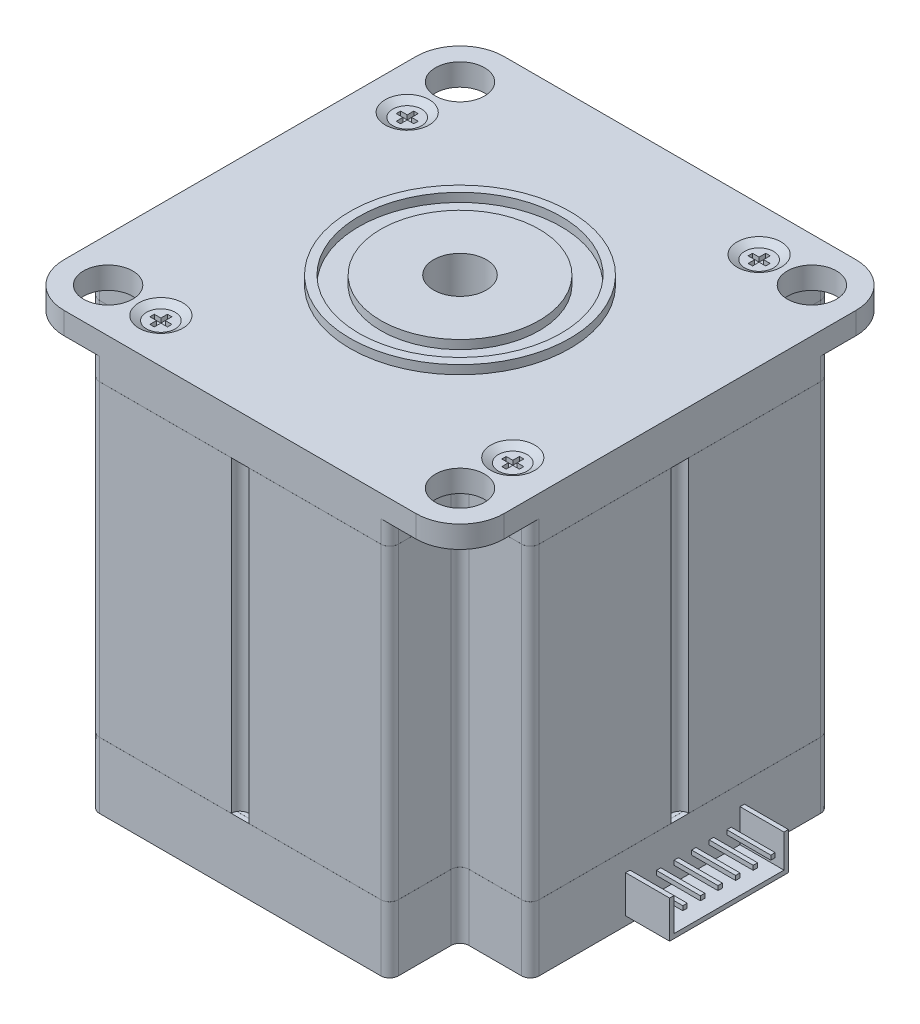
from build123d import *

# Parameters (mm, degrees)
SKETCH1_R                    = 5.580556693
BOSS_EXTRUDE1_DEPTH          = 2.5
SKETCH2_R                    = 5
CUT_EXTRUDE1_DEPTH           = 1
CUT_EXTRUDE1_DRAFT           = -60
CUT_EXTRUDE1_PROFILE_2_DEPTH = 1
CUT_EXTRUDE1_PROFILE_2_DRAFT = -60
CUT_EXTRUDE1_PROFILE_3_DEPTH = 1
CUT_EXTRUDE1_PROFILE_3_DRAFT = -60
CUT_EXTRUDE1_PROFILE_4_DEPTH = 1
CUT_EXTRUDE1_PROFILE_4_DRAFT = -60
CUT_EXTRUDE2_DEPTH           = 1
BOSS_EXTRUDE2_DEPTH          = 5
BOSS_EXTRUDE5_DEPTH          = 0.01
BOSS_EXTRUDE6_DEPTH          = 70
BOSS_EXTRUDE8_DEPTH          = 0.01
BOSS_EXTRUDE9_DEPTH          = 15
BOSS_EXTRUDE10_DEPTH         = 10
SKETCH15_W                   = 1
SKETCH15_H                   = 1
BOSS_EXTRUDE11_DEPTH         = 10
SKETCH19_R                   = 25
SKETCH19_R_2                 = 23
SKETCH19_R_3                 = 18
BOSS_EXTRUDE14_DEPTH         = 2
CUT_EXTRUDE4_DEPTH           = 125.550714169
CUT_EXTRUDE4_DEPTH_BACK      = 125.550714169
SKETCH20_R                   = 6


with BuildPart() as part:
    # Sketch1 → Boss-Extrude1 (new, symmetric)
    with BuildSketch(Plane(origin=(0, 0, 0), x_dir=(1, 0, 0), z_dir=(0, 1, 0))):
        with BuildLine():
            Line((-40, 50), (40, 50))
            ThreePointArc((40, 50), (47.071067812, 47.071067812), (50, 40))
            Line((50, 40), (50, -40))
            ThreePointArc((50, -40), (47.071067812, -47.071067812), (40, -50))
            Line((40, -50), (-40, -50))
            ThreePointArc((-40, -50), (-47.071067812, -47.071067812), (-50, -40))
            Line((-50, -40), (-50, 40))
            ThreePointArc((-50, 40), (-47.071067812, 47.071067812), (-40, 50))
        make_face()
        with Locations(Location((-40, 40, 0), (0, 0, 270))):
            Circle(SKETCH1_R, mode=Mode.SUBTRACT)
        with Locations(Location((-40, -40, 0), (0, 0, 270))):
            Circle(SKETCH1_R, mode=Mode.SUBTRACT)
        with Locations(Location((40, -40, 0), (0, 0, 270))):
            Circle(SKETCH1_R, mode=Mode.SUBTRACT)
        with Locations(Location((40, 40, 0), (0, 0, 270))):
            Circle(SKETCH1_R, mode=Mode.SUBTRACT)
    extrude(amount=BOSS_EXTRUDE1_DEPTH, both=True)


with BuildPart() as cut_extrude1_tool:
    # Sketch2 → Cut-Extrude1 (with draft: the straight prism first)
    with BuildSketch(Plane(origin=(0, 2.5, 0), x_dir=(1, 0, 0), z_dir=(0, 1, 0))):
        with Locations((-40, 28)):
            Circle(SKETCH2_R)
    extrude(amount=-CUT_EXTRUDE1_DEPTH)
    # Cut-Extrude1: the draft: its side faces are tilted about the plane it starts from
    cut_extrude1_sides = [cut_extrude1_tool.faces().sort_by_distance(p)[0] for p in [
        (-45, 2, -28),
    ]]
    draft(cut_extrude1_sides, Plane(origin=(0, 2.5, 0), x_dir=(1, 0, 0), z_dir=(0, 1, 0)), CUT_EXTRUDE1_DRAFT)


with BuildPart() as part_1:
    add(part.part)

    # Cut-Extrude1: cut by cut_extrude1_tool
    add(cut_extrude1_tool.part, mode=Mode.SUBTRACT)


with BuildPart() as cut_extrude1_profile_2_tool:
    # Sketch2 → Cut-Extrude1 profile 2 (with draft: the straight prism first)
    with BuildSketch(Plane(origin=(0, 2.5, 0), x_dir=(1, 0, 0), z_dir=(0, 1, 0))):
        with Locations((28, 40)):
            Circle(SKETCH2_R)
    extrude(amount=-CUT_EXTRUDE1_PROFILE_2_DEPTH)
    # Cut-Extrude1 profile 2: the draft: its side faces are tilted about the plane it starts from
    cut_extrude1_profile_2_sides = [cut_extrude1_profile_2_tool.faces().sort_by_distance(p)[0] for p in [
        (23, 2, -40),
    ]]
    draft(cut_extrude1_profile_2_sides, Plane(origin=(0, 2.5, 0), x_dir=(1, 0, 0), z_dir=(0, 1, 0)), CUT_EXTRUDE1_PROFILE_2_DRAFT)


with BuildPart() as part_2:
    add(part_1.part)

    # Cut-Extrude1 profile 2: cut by cut_extrude1_profile_2_tool
    add(cut_extrude1_profile_2_tool.part, mode=Mode.SUBTRACT)


with BuildPart() as cut_extrude1_profile_3_tool:
    # Sketch2 → Cut-Extrude1 profile 3 (with draft: the straight prism first)
    with BuildSketch(Plane(origin=(0, 2.5, 0), x_dir=(1, 0, 0), z_dir=(0, 1, 0))):
        with Locations((-28, -40)):
            Circle(SKETCH2_R)
    extrude(amount=-CUT_EXTRUDE1_PROFILE_3_DEPTH)
    # Cut-Extrude1 profile 3: the draft: its side faces are tilted about the plane it starts from
    cut_extrude1_profile_3_sides = [cut_extrude1_profile_3_tool.faces().sort_by_distance(p)[0] for p in [
        (-33, 2, 40),
    ]]
    draft(cut_extrude1_profile_3_sides, Plane(origin=(0, 2.5, 0), x_dir=(1, 0, 0), z_dir=(0, 1, 0)), CUT_EXTRUDE1_PROFILE_3_DRAFT)


with BuildPart() as part_3:
    add(part_2.part)

    # Cut-Extrude1 profile 3: cut by cut_extrude1_profile_3_tool
    add(cut_extrude1_profile_3_tool.part, mode=Mode.SUBTRACT)


with BuildPart() as cut_extrude1_profile_4_tool:
    # Sketch2 → Cut-Extrude1 profile 4 (with draft: the straight prism first)
    with BuildSketch(Plane(origin=(0, 2.5, 0), x_dir=(1, 0, 0), z_dir=(0, 1, 0))):
        with Locations((40, -28)):
            Circle(SKETCH2_R)
    extrude(amount=-CUT_EXTRUDE1_PROFILE_4_DEPTH)
    # Cut-Extrude1 profile 4: the draft: its side faces are tilted about the plane it starts from
    cut_extrude1_profile_4_sides = [cut_extrude1_profile_4_tool.faces().sort_by_distance(p)[0] for p in [
        (35, 2, 28),
    ]]
    draft(cut_extrude1_profile_4_sides, Plane(origin=(0, 2.5, 0), x_dir=(1, 0, 0), z_dir=(0, 1, 0)), CUT_EXTRUDE1_PROFILE_4_DRAFT)


with BuildPart() as part_4:
    add(part_3.part)

    # Cut-Extrude1 profile 4: cut by cut_extrude1_profile_4_tool
    add(cut_extrude1_profile_4_tool.part, mode=Mode.SUBTRACT)

    # Sketch3 → Cut-Extrude2 (cut)
    with BuildSketch(Plane(origin=(0, 1.5, 0), x_dir=(1, 0, 0), z_dir=(0, 1, 0))):
        Polygon((-39.5, 28.5), (-38, 28.5), (-38, 27.5), (-39.5, 27.5), (-39.5, 26), (-40.5, 26), (-40.5, 27.5), (-42, 27.5), (-42, 28.5), (-40.5, 28.5), (-40.5, 30), (-39.5, 30), align=None)
        Polygon((27.5, 39.5), (27.5, 38), (28.5, 38), (28.5, 39.5), (30, 39.5), (30, 40.5), (28.5, 40.5), (28.5, 42), (27.5, 42), (27.5, 40.5), (26, 40.5), (26, 39.5), align=None)
        Polygon((-27.5, -40.5), (-27.5, -42), (-28.5, -42), (-28.5, -40.5), (-30, -40.5), (-30, -39.5), (-28.5, -39.5), (-28.5, -38), (-27.5, -38), (-27.5, -39.5), (-26, -39.5), (-26, -40.5), align=None)
        Polygon((40.5, -27.5), (42, -27.5), (42, -28.5), (40.5, -28.5), (40.5, -30), (39.5, -30), (39.5, -28.5), (38, -28.5), (38, -27.5), (39.5, -27.5), (39.5, -26), (40.5, -26), align=None)
    extrude(amount=-CUT_EXTRUDE2_DEPTH, mode=Mode.SUBTRACT)

    # Sketch4 → Boss-Extrude2 (add)
    with BuildSketch(Plane.XZ.offset(2.5)):
        with BuildLine():
            Line((-34, 48), (-34, 36))
            ThreePointArc((-34, 36), (-34.585786438, 34.585786438), (-36, 34))
            Line((-36, 34), (-48, 34))
            ThreePointArc((-48, 34), (-49.414213562, 33.414213562), (-50, 32))
            Line((-50, 32), (-50, -32))
            ThreePointArc((-50, -32), (-49.414213562, -33.414213562), (-48, -34))
            Line((-48, -34), (-36, -34))
            ThreePointArc((-36, -34), (-34.585786438, -34.585786438), (-34, -36))
            Line((-34, -36), (-34, -48))
            ThreePointArc((-34, -48), (-33.414213562, -49.414213562), (-32, -50))
            Line((-32, -50), (32, -50))
            ThreePointArc((32, -50), (33.414213562, -49.414213562), (34, -48))
            Line((34, -48), (34, -36))
            ThreePointArc((34, -36), (34.585786438, -34.585786438), (36, -34))
            Line((36, -34), (48, -34))
            ThreePointArc((48, -34), (49.414213562, -33.414213562), (50, -32))
            Line((50, -32), (50, 32))
            ThreePointArc((50, 32), (49.414213562, 33.414213562), (48, 34))
            Line((48, 34), (36, 34))
            ThreePointArc((36, 34), (34.585786438, 34.585786438), (34, 36))
            Line((34, 36), (34, 48))
            ThreePointArc((34, 48), (33.414213562, 49.414213562), (32, 50))
            Line((32, 50), (-32, 50))
            ThreePointArc((-32, 50), (-33.414213562, 49.414213562), (-34, 48))
        make_face()
    extrude(amount=BOSS_EXTRUDE2_DEPTH)

    # Sketch9 → Boss-Extrude5 (add)
    with BuildSketch(Plane.XZ.offset(7.5)):
        with BuildLine():
            Line((32, 49), (-32, 49))
            ThreePointArc((-32, 49), (-32.707106781, 48.707106781), (-33, 48))
            Line((-33, 48), (-33, 36))
            ThreePointArc((-33, 36), (-33.878679656, 33.878679656), (-36, 33))
            Line((-36, 33), (-48, 33))
            ThreePointArc((-48, 33), (-48.707106781, 32.707106781), (-49, 32))
            Line((-49, 32), (-49, -32))
            ThreePointArc((-49, -32), (-48.707106781, -32.707106781), (-48, -33))
            Line((-48, -33), (-36, -33))
            ThreePointArc((-36, -33), (-33.878679656, -33.878679656), (-33, -36))
            Line((-33, -36), (-33, -48))
            ThreePointArc((-33, -48), (-32.707106781, -48.707106781), (-32, -49))
            Line((-32, -49), (32, -49))
            ThreePointArc((32, -49), (32.707106781, -48.707106781), (33, -48))
            Line((33, -48), (33, -36))
            ThreePointArc((33, -36), (33.878679656, -33.878679656), (36, -33))
            Line((36, -33), (48, -33))
            ThreePointArc((48, -33), (48.707106781, -32.707106781), (49, -32))
            Line((49, -32), (49, 32))
            ThreePointArc((49, 32), (48.707106781, 32.707106781), (48, 33))
            Line((48, 33), (36, 33))
            ThreePointArc((36, 33), (33.878679656, 33.878679656), (33, 36))
            Line((33, 36), (33, 48))
            ThreePointArc((33, 48), (32.707106781, 48.707106781), (32, 49))
        make_face()
    extrude(amount=BOSS_EXTRUDE5_DEPTH)

    # Sketch10 → Boss-Extrude6 (add)
    with BuildSketch(Plane.XZ.offset(7.51)):
        with BuildLine():
            Line((2, -50), (32, -50))
            ThreePointArc((32, -50), (33.414213562, -49.414213562), (34, -48))
            Line((34, -48), (34, -36))
            ThreePointArc((34, -36), (34.585786438, -34.585786438), (36, -34))
            Line((36, -34), (48, -34))
            ThreePointArc((48, -34), (49.414213562, -33.414213562), (50, -32))
            Line((50, -32), (50, -2))
            ThreePointArc((50, -2), (48, 0), (50, 2))
            Line((50, 2), (50, 32))
            ThreePointArc((50, 32), (49.414213562, 33.414213562), (48, 34))
            Line((48, 34), (36, 34))
            ThreePointArc((36, 34), (34.585786438, 34.585786438), (34, 36))
            Line((34, 36), (34, 48))
            ThreePointArc((34, 48), (33.414213562, 49.414213562), (32, 50))
            Line((32, 50), (2, 50))
            ThreePointArc((2, 50), (0, 48), (-2, 50))
            Line((-2, 50), (-32, 50))
            ThreePointArc((-32, 50), (-33.414213562, 49.414213562), (-34, 48))
            Line((-34, 48), (-34, 36))
            ThreePointArc((-34, 36), (-34.585786438, 34.585786438), (-36, 34))
            Line((-36, 34), (-48, 34))
            ThreePointArc((-48, 34), (-49.414213562, 33.414213562), (-50, 32))
            Line((-50, 32), (-50, 2))
            ThreePointArc((-50, 2), (-48, 0), (-50, -2))
            Line((-50, -2), (-50, -32))
            ThreePointArc((-50, -32), (-49.414213562, -33.414213562), (-48, -34))
            Line((-48, -34), (-36, -34))
            ThreePointArc((-36, -34), (-34.585786438, -34.585786438), (-34, -36))
            Line((-34, -36), (-34, -48))
            ThreePointArc((-34, -48), (-33.414213562, -49.414213562), (-32, -50))
            Line((-32, -50), (-2, -50))
            ThreePointArc((-2, -50), (0, -48), (2, -50))
        make_face()
    extrude(amount=BOSS_EXTRUDE6_DEPTH)

    # Sketch12 → Boss-Extrude8 (add)
    with BuildSketch(Plane.XZ.offset(77.51)):
        with BuildLine():
            Line((-49, 2.828427125), (-49, -2.828427125))
            Line((-49, -2.828427125), (-49, -32))
            ThreePointArc((-49, -32), (-48.707106781, -32.707106781), (-48, -33))
            Line((-48, -33), (-36, -33))
            ThreePointArc((-36, -33), (-33.878679656, -33.878679656), (-33, -36))
            Line((-33, -36), (-33, -48))
            ThreePointArc((-33, -48), (-32.707106781, -48.707106781), (-32, -49))
            Line((-32, -49), (-2.828427125, -49))
            Line((-2.828427125, -49), (2.828427125, -49))
            Line((2.828427125, -49), (32, -49))
            ThreePointArc((32, -49), (32.707106781, -48.707106781), (33, -48))
            Line((33, -48), (33, -36))
            ThreePointArc((33, -36), (33.878679656, -33.878679656), (36, -33))
            Line((36, -33), (48, -33))
            ThreePointArc((48, -33), (48.707106781, -32.707106781), (49, -32))
            Line((49, -32), (49, -2.828427125))
            Line((49, -2.828427125), (49, 2.828427125))
            Line((49, 2.828427125), (49, 32))
            ThreePointArc((49, 32), (48.707106781, 32.707106781), (48, 33))
            Line((48, 33), (36, 33))
            ThreePointArc((36, 33), (33.878679656, 33.878679656), (33, 36))
            Line((33, 36), (33, 48))
            ThreePointArc((33, 48), (32.707106781, 48.707106781), (32, 49))
            Line((32, 49), (2.828427125, 49))
            Line((2.828427125, 49), (-2.828427125, 49))
            Line((-2.828427125, 49), (-32, 49))
            ThreePointArc((-32, 49), (-32.707106781, 48.707106781), (-33, 48))
            Line((-33, 48), (-33, 36))
            ThreePointArc((-33, 36), (-33.878679656, 33.878679656), (-36, 33))
            Line((-36, 33), (-48, 33))
            ThreePointArc((-48, 33), (-48.707106781, 32.707106781), (-49, 32))
            Line((-49, 32), (-49, 2.828427125))
        make_face()
    extrude(amount=BOSS_EXTRUDE8_DEPTH)

    # Sketch13 → Boss-Extrude9 (add)
    with BuildSketch(Plane.XZ.offset(77.52)):
        with BuildLine():
            Line((32, 50), (-32, 50))
            ThreePointArc((-32, 50), (-33.414213562, 49.414213562), (-34, 48))
            Line((-34, 48), (-34, 36))
            ThreePointArc((-34, 36), (-34.585786438, 34.585786438), (-36, 34))
            Line((-36, 34), (-48, 34))
            ThreePointArc((-48, 34), (-49.414213562, 33.414213562), (-50, 32))
            Line((-50, 32), (-50, -32))
            ThreePointArc((-50, -32), (-49.414213562, -33.414213562), (-48, -34))
            Line((-48, -34), (-36, -34))
            ThreePointArc((-36, -34), (-34.585786438, -34.585786438), (-34, -36))
            Line((-34, -36), (-34, -48))
            ThreePointArc((-34, -48), (-33.414213562, -49.414213562), (-32, -50))
            Line((-32, -50), (32, -50))
            ThreePointArc((32, -50), (33.414213562, -49.414213562), (34, -48))
            Line((34, -48), (34, -36))
            ThreePointArc((34, -36), (34.585786438, -34.585786438), (36, -34))
            Line((36, -34), (48, -34))
            ThreePointArc((48, -34), (49.414213562, -33.414213562), (50, -32))
            Line((50, -32), (50, 32))
            ThreePointArc((50, 32), (49.414213562, 33.414213562), (48, 34))
            Line((48, 34), (36, 34))
            ThreePointArc((36, 34), (34.585786438, 34.585786438), (34, 36))
            Line((34, 36), (34, 48))
            ThreePointArc((34, 48), (33.414213562, 49.414213562), (32, 50))
        make_face()
    extrude(amount=BOSS_EXTRUDE9_DEPTH)

    # Sketch14 → Boss-Extrude10 (add)
    with BuildSketch(Plane(origin=(50, 0, 0), x_dir=(0, 0, -1), z_dir=(1, 0, 0))):
        Polygon((13.650882329, -82.02), (14.650882329, -82.02), (14.650882329, -90.52), (-12.349117671, -90.52), (-12.349117671, -82.02), (-11.349117671, -82.02), (-11.349117671, -89.52), (13.650882329, -89.52), align=None)
    extrude(amount=BOSS_EXTRUDE10_DEPTH)

    # Sketch15 → Boss-Extrude11 (add)
    with BuildSketch(Plane(origin=(50, 0, 0), x_dir=(0, 0, -1), z_dir=(1, 0, 0))):
        with Locations((-8.849117671, -85.52)):
            Rectangle(SKETCH15_W, SKETCH15_H)
        with Locations((-4.849117671, -85.565002093)):
            Rectangle(SKETCH15_W, SKETCH15_H)
        with Locations((-0.849117671, -85.565002093)):
            Rectangle(SKETCH15_W, SKETCH15_H)
        with Locations((3.150882329, -85.565002093)):
            Rectangle(SKETCH15_W, SKETCH15_H)
        with Locations((7.150882329, -85.565002093)):
            Rectangle(SKETCH15_W, SKETCH15_H)
        with Locations((11.150882329, -85.565002093)):
            Rectangle(SKETCH15_W, SKETCH15_H)
    extrude(amount=BOSS_EXTRUDE11_DEPTH)

    # Sketch19 → Boss-Extrude14 (add)
    # profile 1 of 2: a face of its own
    with BuildSketch(Plane(origin=(0, 2.5, 0), x_dir=(1, 0, 0), z_dir=(0, 1, 0))):
        with Locations(Location((0, 0, 0), (0, 0, 270))):
            Circle(SKETCH19_R)
        with Locations(Location((0, 0, 0), (0, 0, 270))):
            Circle(SKETCH19_R_2, mode=Mode.SUBTRACT)
    # profile 2 of 2: a face of its own
    with BuildSketch(Plane(origin=(0, 2.5, 0), x_dir=(1, 0, 0), z_dir=(0, 1, 0))):
        with Locations(Location((0, 0, 0), (0, 0, 270))):
            Circle(SKETCH19_R_3)
    extrude(amount=BOSS_EXTRUDE14_DEPTH)

    # Sketch20 → Cut-Extrude4 (cut, two sides: drawn at the far end of the back side and taken through both)
    with BuildSketch(Plane(origin=(0, 4.5, 0), x_dir=(1, 0, 0), z_dir=(0, 1, 0)).offset(-CUT_EXTRUDE4_DEPTH_BACK)):
        with Locations(Location((0, 0, 0), (0, 0, 270))):
            Circle(SKETCH20_R)
    extrude(amount=CUT_EXTRUDE4_DEPTH + CUT_EXTRUDE4_DEPTH_BACK, mode=Mode.SUBTRACT)


solid = part_4.part
